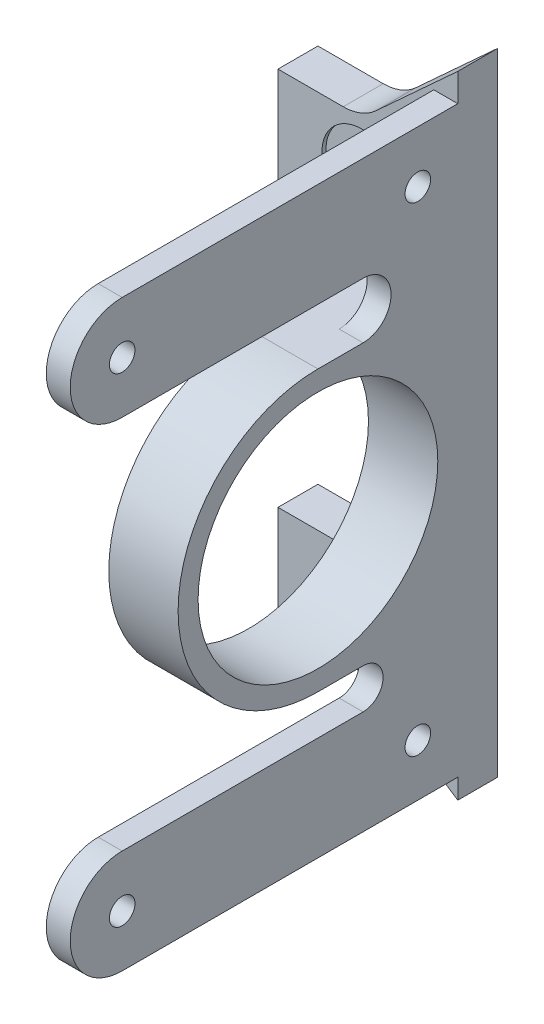
from build123d import *

# Parameters (mm, degrees)
EXTRUDE_2_DEPTH                = 5
SKETCH_4_W                     = 8.676470589
SKETCH_4_H                     = 35
SKETCH_4_W_2                   = 8.676470588
EXTRUDE_15_DEPTH               = 35
CUT_EXTRUDE_1_DEPTH            = 45
SKETCH_6_R                     = 15
CUT_EXTRUDE_2_DEPTH            = 45
FILLET_1_R                     = 5
EXTRUDE_START                  = -1
SKETCH_7_R                     = 15
SKETCH_7_R_2                   = 13
EXTRUDE_16_DEPTH               = 1
SPLIT_BODIES_1_SURFACE_1_BACK  = 86
SPLIT_BODIES_1_SURFACE_1_DEPTH = 172
SPLIT_BODIES_1_SURFACE_2_BACK  = 86
SPLIT_BODIES_1_SURFACE_2_DEPTH = 172
SKETCH_17_W                    = 3
SKETCH_17_H                    = 13
EXTRUDE_20_DEPTH               = 42
HOLE_WIZARD_1_D                = 4.3
HOLE_WIZARD_1_DEPTH            = 5
HOLE_WIZARD_1_CBORE_D          = 10
HOLE_WIZARD_1_CBORE_DEPTH      = 0.5
HOLE_WIZARD_1_TIP              = 1.291850331
EXTRUDE_21_DEPTH               = 3
SKETCH_33_R                    = 1.6
CUT_EXTRUDE_3_DEPTH            = 3
EXTRUDE_22_DEPTH               = 5
FILLET_2_R                     = 6


with BuildPart() as part:
    # 草图2 → 凸台-拉伸2 (new body)
    with BuildSketch(Plane.XY):
        Polygon((7.726423565, 24.338235294), (-14.773576435, 24.338235294), (-14.773576435, -35.661764706), (7.726423565, -35.661764706), (7.726423565, -23.161764706), (-6.097105846, -23.161764706), (-6.097105846, 11.838235294), (7.726423565, 11.838235294), align=None)
        Polygon((30.226423565, 24.338235294), (7.726423565, 24.338235294), (7.726423565, 11.838235294), (21.549952977, 11.838235294), (21.549952977, -23.161764706), (7.726423565, -23.161764706), (7.726423565, -35.661764706), (30.226423565, -35.661764706), align=None)
    extrude(amount=EXTRUDE_2_DEPTH)

    # 草图4 → 凸台-拉伸15 (add)
    with BuildSketch(Plane.XY.offset(5)):
        with Locations((-10.435341141, -5.661764706)):
            Rectangle(SKETCH_4_W, SKETCH_4_H)
        with Locations((25.888188271, -5.661764706)):
            Rectangle(SKETCH_4_W_2, SKETCH_4_H)
    extrude(amount=EXTRUDE_15_DEPTH)

    # 草图5 → 切除-拉伸1 (cut)
    with BuildSketch(Plane.ZY.offset(14.773576435)):
        with BuildLine():
            Line((40, -23.161764706), (40, -5.661764706))
            ThreePointArc((40, -5.661764706), (34.874368671, -18.036133377), (22.5, -23.161764706))
            Line((22.5, -23.161764706), (40, -23.161764706))
        make_face()
        with BuildLine():
            ThreePointArc((22.5, 11.838235294), (34.874368671, 6.712603965), (40, -5.661764706))
            Line((40, -5.661764706), (40, 11.838235294))
            Line((40, 11.838235294), (22.5, 11.838235294))
        make_face()
    extrude(amount=-CUT_EXTRUDE_1_DEPTH, mode=Mode.SUBTRACT)

    # 草图6 → 切除-拉伸2 (cut)
    with BuildSketch(Plane.ZY.offset(14.773576435)):
        with Locations((22.5, -5.661764706)):
            Circle(SKETCH_6_R)
    extrude(amount=-CUT_EXTRUDE_2_DEPTH, mode=Mode.SUBTRACT)

    # 圆角1
    fillet_1_edges = [part.edges().sort_by_distance(p)[0] for p in [
        (-6.097105846, 11.838235294, 2.5),
        (-6.097105846, -23.161764706, 2.5),
        (21.549952977, -23.161764706, 2.5),
        (21.549952977, 11.838235294, 2.5),
    ]]
    fillet(fillet_1_edges, radius=FILLET_1_R)

    # 草图7 → 凸台-拉伸16 (add)
    with BuildSketch(Plane(origin=(-6.097105846, 0, 0), x_dir=(0, 0, -1), z_dir=(1, 0, 0)).offset(EXTRUDE_START)):
        with Locations(Location((-22.5, -5.661764706, 0), (0, 0, 180))):
            Circle(SKETCH_7_R)
        with Locations((-22.5, -5.661764706)):
            Circle(SKETCH_7_R_2, mode=Mode.SUBTRACT)
    extrude(amount=EXTRUDE_16_DEPTH)


with BuildPart() as body_2:
    # Split Bodies 1: the piece behind the surface
    add(part.part)
    # Split Bodies 1 surface: a surface, the sketch's curves swept straight by 172 mm
    with BuildLine(Plane.XY.offset(5).offset(-SPLIT_BODIES_1_SURFACE_1_BACK), mode=Mode.PRIVATE) as split_bodies_1_surface_1_path:
        Line((7.726423565, 24.338235294), (7.726423565, -35.661764706))
    split_bodies_1_surface_1 = Shell.extrude(split_bodies_1_surface_1_path.wire(), (0 * SPLIT_BODIES_1_SURFACE_1_DEPTH, 0 * SPLIT_BODIES_1_SURFACE_1_DEPTH, 1 * SPLIT_BODIES_1_SURFACE_1_DEPTH))
    split(bisect_by=split_bodies_1_surface_1, keep=Keep.BOTTOM)


with BuildPart() as part_1:
    add(part.part)

    # Split Bodies 1: split by a surface, the side it looks to stays
    # Split Bodies 1 surface: a surface, the sketch's curves swept straight by 172 mm
    with BuildLine(Plane.XY.offset(5).offset(-SPLIT_BODIES_1_SURFACE_2_BACK), mode=Mode.PRIVATE) as split_bodies_1_surface_2_path:
        Line((7.726423565, 24.338235294), (7.726423565, -35.661764706))
    split_bodies_1_surface_2 = Shell.extrude(split_bodies_1_surface_2_path.wire(), (0 * SPLIT_BODIES_1_SURFACE_2_DEPTH, 0 * SPLIT_BODIES_1_SURFACE_2_DEPTH, 1 * SPLIT_BODIES_1_SURFACE_2_DEPTH))
    split(bisect_by=split_bodies_1_surface_2, keep=Keep.TOP)

    # 草图17 → 凸台-拉伸20 (add)
    with BuildSketch(Plane.XY.offset(5)):
        with Locations((28.726423565, -34.661764706)):
            Rectangle(SKETCH_17_W, SKETCH_17_H)
        with Locations((28.726423565, 25.338235294)):
            Rectangle(SKETCH_17_W, SKETCH_17_H)
    extrude(amount=EXTRUDE_20_DEPTH)

    # 打孔尺寸(%根据六角头螺)栓 全螺纹的类型1
    with Locations(Plane(origin=(18.226423565, 18.088235294, 5), x_dir=(1, 0, 0), z_dir=(0, 0, 1))):
        with Locations((0, 0), (0, -47.5)):
            CounterBoreHole(HOLE_WIZARD_1_D / 2, HOLE_WIZARD_1_CBORE_D / 2, HOLE_WIZARD_1_CBORE_DEPTH, depth=HOLE_WIZARD_1_DEPTH)
            with Locations((0, 0, -(HOLE_WIZARD_1_DEPTH + HOLE_WIZARD_1_TIP / 2))):  # 118° drill point
                Cone(0, HOLE_WIZARD_1_D / 2, HOLE_WIZARD_1_TIP, mode=Mode.SUBTRACT)

    # 草图32 → 凸台-拉伸21 (add)
    with BuildSketch(Plane(origin=(30.226423565, 0, 0), x_dir=(0, 0, -1), z_dir=(1, 0, 0))):
        with BuildLine():
            Line((-47, 31.838235294), (-47, 18.838235294))
            ThreePointArc((-47, 18.838235294), (-53.5, 25.338235294), (-47, 31.838235294))
        make_face()
        with BuildLine():
            Line((-47, -28.161764706), (-47, -41.161764706))
            ThreePointArc((-47, -41.161764706), (-53.5, -34.661764706), (-47, -28.161764706))
        make_face()
        with BuildLine():
            Line((-16.851482017, 11.838235294), (-5, 11.838235294))
            Line((-5, 11.838235294), (-5, 18.838235294))
            Line((-5, 18.838235294), (-16.851482017, 18.838235294))
            ThreePointArc((-16.851482017, 18.838235294), (-13.351482017, 15.338235294), (-16.851482017, 11.838235294))
        make_face()
        with BuildLine():
            Line((-16.851482017, -23.161764706), (-5, -23.161764706))
            Line((-5, -23.161764706), (-5, -28.161764706))
            Line((-5, -28.161764706), (-16.851482017, -28.161764706))
            ThreePointArc((-16.851482017, -28.161764706), (-14.351482017, -25.661764706), (-16.851482017, -23.161764706))
        make_face()
    extrude(amount=-EXTRUDE_21_DEPTH)

    # 草图33 → 切除-拉伸3 (cut)
    with BuildSketch(Plane(origin=(30.226423565, 0, 0), x_dir=(0, 0, -1), z_dir=(1, 0, 0))):
        with Locations((-47, 25.338235294)):
            Circle(SKETCH_33_R)
        with Locations((-47, -34.661764706)):
            Circle(SKETCH_33_R)
        with Locations((-10, 25.338235294)):
            Circle(SKETCH_33_R)
        with Locations((-10, -34.661764706)):
            Circle(SKETCH_33_R)
    extrude(amount=-CUT_EXTRUDE_3_DEPTH, mode=Mode.SUBTRACT)

    # 草图34 → 凸台-拉伸22 (add)
    with BuildSketch(Plane.XY.offset(5)):
        Polygon((18.226423565, 24.338235294), (30.226423565, 24.338235294), (30.226423565, 35.338235294), align=None)
        Polygon((18.226423565, -35.661764706), (30.226423565, -35.661764706), (30.226423565, -43.661764706), align=None)
    extrude(amount=-EXTRUDE_22_DEPTH)

    # 圆角2
    fillet_2_edges = [part_1.edges().sort_by_distance(p)[0] for p in [
        (18.226423565, 24.338235294, 2.5),
        (18.226423565, -35.661764706, 2.5),
    ]]
    fillet(fillet_2_edges, radius=FILLET_2_R)


solid = part_1.part
